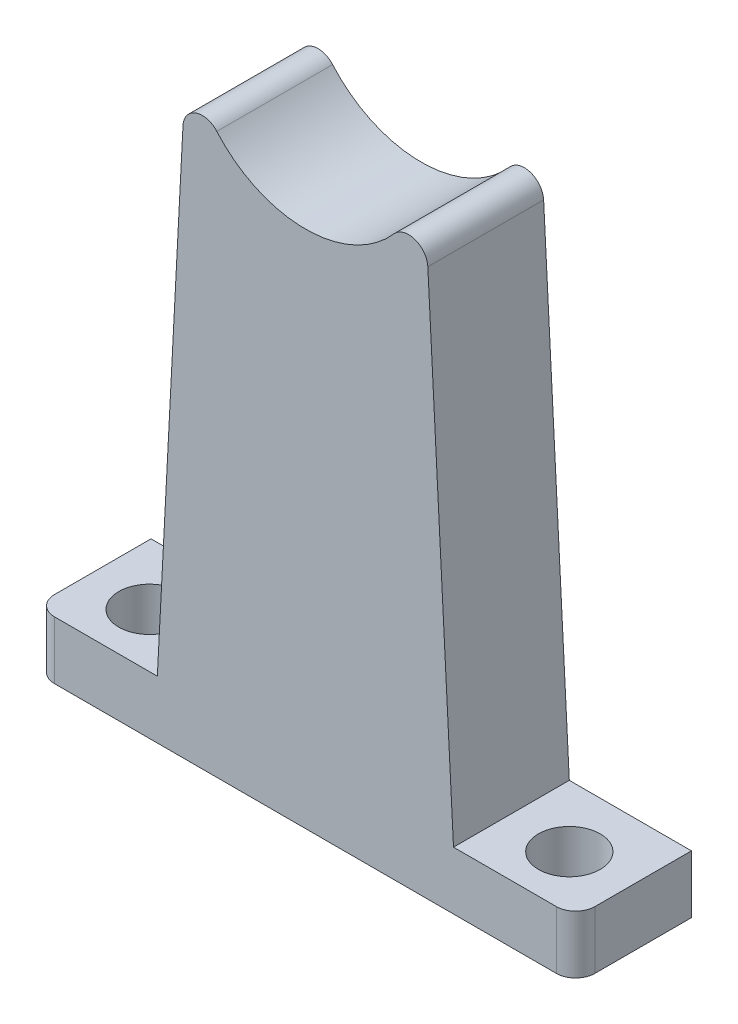
from build123d import *

# Parameters (mm, degrees)
BOSS_EXTRUDE1_DEPTH = 6
SKETCH2_R           = 1.6
CUT_EXTRUDE1_DEPTH  = 10
FILLET1_R           = 1


with BuildPart() as part:
    # Sketch1 → Boss-Extrude1 (new body)
    with BuildSketch(Plane.XY):
        with BuildLine():
            Line((-6.342263295, -37.122659043), (-7.672233378, -62.5))
            Line((-7.672233378, -62.5), (-14, -62.5))
            Line((-14, -62.5), (-14, -65.5))
            Line((-14, -65.5), (14, -65.5))
            Line((14, -65.5), (14, -62.5))
            Line((14, -62.5), (7.672233378, -62.5))
            Line((7.672233378, -62.5), (6.342263295, -37.122659043))
            ThreePointArc((6.342263295, -37.122659043), (5.670701308, -36.229994036), (4.591009287, -36.516544999))
            ThreePointArc((4.591009287, -36.516544999), (0, -38.6), (-4.591009287, -36.516544999))
            ThreePointArc((-4.591009287, -36.516544999), (-5.670701308, -36.229994036), (-6.342263295, -37.122659043))
        make_face()
    extrude(amount=BOSS_EXTRUDE1_DEPTH)

    # Sketch2 → Cut-Extrude1 (cut)
    with BuildSketch(Plane.XZ.offset(65.5)):
        with Locations(Location((10.872233378, 3.2, 0), (0, 0, 270))):
            Circle(SKETCH2_R)
        with Locations(Location((-10.872233378, 3.2, 0), (0, 0, 270))):
            Circle(SKETCH2_R)
    extrude(amount=-CUT_EXTRUDE1_DEPTH, mode=Mode.SUBTRACT)

    # Fillet1
    fillet1_edges = [part.edges().sort_by_distance(p)[0] for p in [
        (-14, -64, 6),
        (14, -64, 6),
    ]]
    fillet(fillet1_edges, radius=FILLET1_R)


solid = part.part
